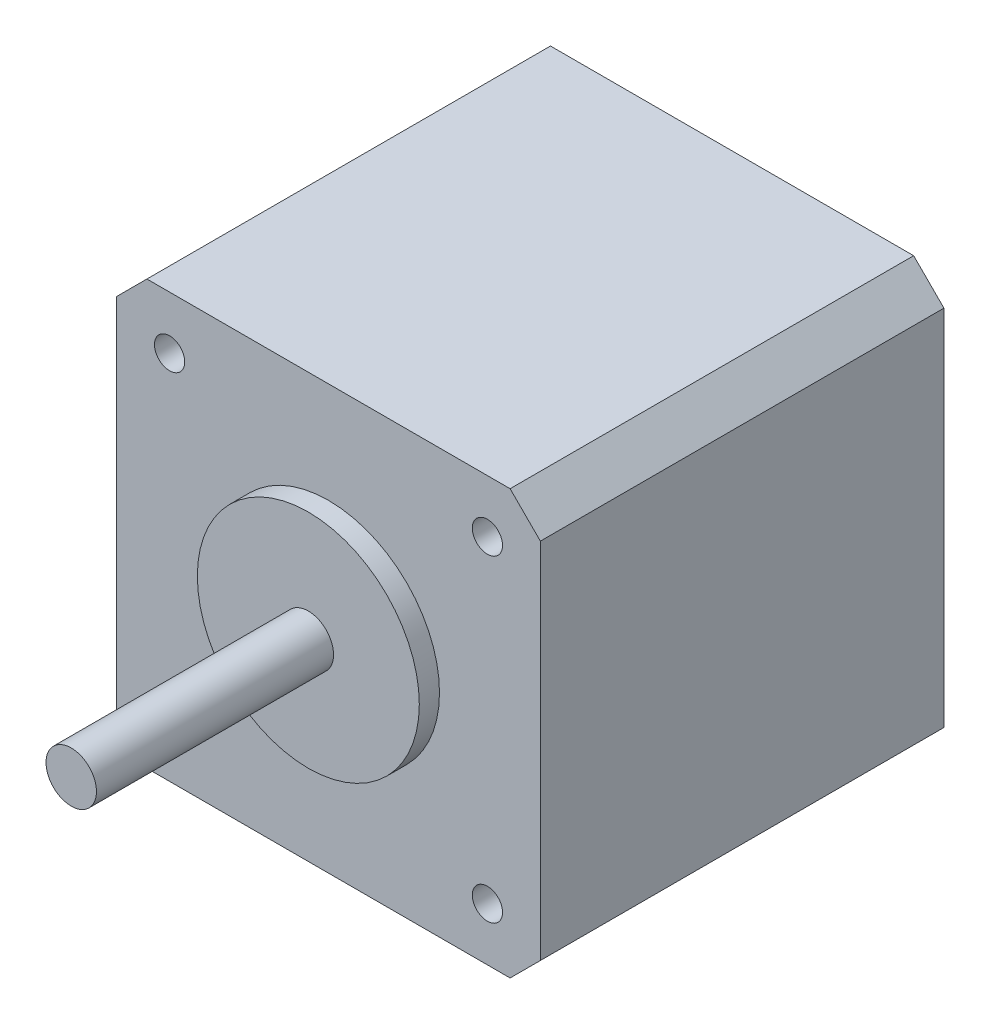
from build123d import *

# Parameters (mm, degrees)
SKETCH1_W           = 42
SKETCH1_H           = 42
BOSS_EXTRUDE1_DEPTH = 40
SKETCH2_R           = 11
BOSS_EXTRUDE2_DEPTH = 2
SKETCH3_R           = 2.5
BOSS_EXTRUDE3_DEPTH = 23.5
CHAMFER1_SIZE       = 3
SKETCH4_R           = 1.5
CUT_EXTRUDE1_DEPTH  = 10


with BuildPart() as part:
    # Sketch1 → Boss-Extrude1 (new body)
    with BuildSketch(Plane.XY):
        Rectangle(SKETCH1_W, SKETCH1_H)
    extrude(amount=BOSS_EXTRUDE1_DEPTH)

    # Sketch2 → Boss-Extrude2 (add)
    with BuildSketch(Plane.XY.offset(40)):
        Circle(SKETCH2_R)
    extrude(amount=BOSS_EXTRUDE2_DEPTH)

    # Sketch3 → Boss-Extrude3 (add)
    with BuildSketch(Plane.XY.offset(42)):
        Circle(SKETCH3_R)
    extrude(amount=BOSS_EXTRUDE3_DEPTH)

    # Chamfer1
    chamfer1_edges = [part.edges().sort_by_distance(p)[0] for p in [
        (21, -21, 20),
        (-21, -21, 20),
        (-21, 21, 20),
        (21, 21, 20),
    ]]
    chamfer(chamfer1_edges, length=CHAMFER1_SIZE)

    # Sketch4 → Cut-Extrude1 (cut)
    with BuildSketch(Plane.XY.offset(40)):
        with Locations((-15.75, 15.75)):
            Circle(SKETCH4_R)
        with Locations((15.75, 15.75)):
            Circle(SKETCH4_R)
        with Locations((-15.75, -15.75)):
            Circle(SKETCH4_R)
        with Locations((15.75, -15.75)):
            Circle(SKETCH4_R)
    extrude(amount=-CUT_EXTRUDE1_DEPTH, mode=Mode.SUBTRACT)


solid = part.part
